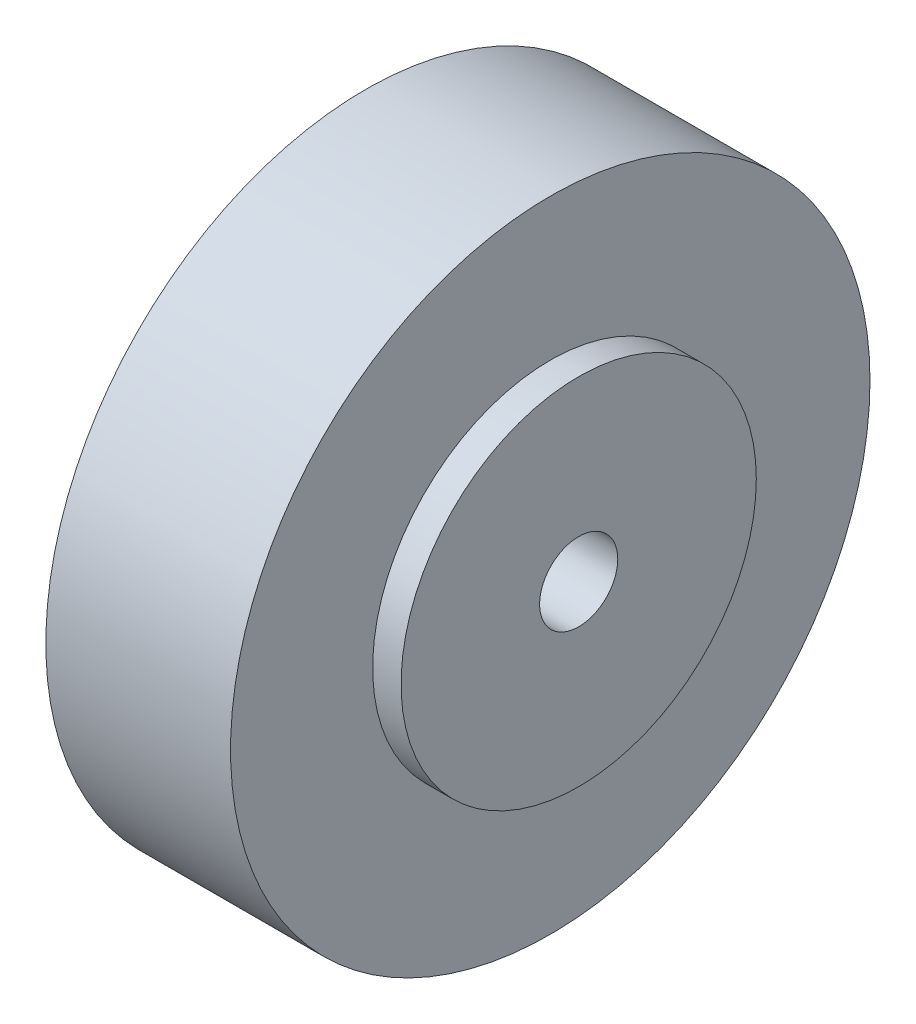
from build123d import *

# Parameters (mm, degrees)
SKETCH1_R               = 22.5
BOSS_EXTRUDE1_DEPTH     = 15
SKETCH2_R               = 2.75
CUT_EXTRUDE1_DEPTH      = 36.178118199
SKETCH5_R               = 8.1
CUT_EXTRUDE2_DEPTH      = 5.5
SKETCH28_R              = 22.5
SKETCH28_R_2            = 12.5
CUT_EXTRUDE_THIN1_DEPTH = 2


with BuildPart() as part:
    # Sketch1 → Boss-Extrude1 (new body)
    with BuildSketch(Plane(origin=(0, 0, 0), x_dir=(0, 0, -1), z_dir=(1, 0, 0))):
        Circle(SKETCH1_R)
    extrude(amount=-BOSS_EXTRUDE1_DEPTH)

    # Sketch2 → Cut-Extrude1 (cut, through all)
    with BuildSketch(Plane(origin=(0, 0, 0), x_dir=(0, 0, -1), z_dir=(1, 0, 0))):
        Circle(SKETCH2_R)
    extrude(amount=-CUT_EXTRUDE1_DEPTH, mode=Mode.SUBTRACT)

    # Sketch5 → Cut-Extrude2 (cut)
    with BuildSketch(Plane.ZY.offset(15)):
        Circle(SKETCH5_R)
    extrude(amount=-CUT_EXTRUDE2_DEPTH, mode=Mode.SUBTRACT)

    # Sketch28 → Cut-Extrude-Thin1 (cut)
    with BuildSketch(Plane(origin=(0, 0, 0), x_dir=(0, 0, -1), z_dir=(1, 0, 0))):
        Circle(SKETCH28_R)
        Circle(SKETCH28_R_2, mode=Mode.SUBTRACT)
    extrude(amount=-CUT_EXTRUDE_THIN1_DEPTH, mode=Mode.SUBTRACT)


solid = part.part
